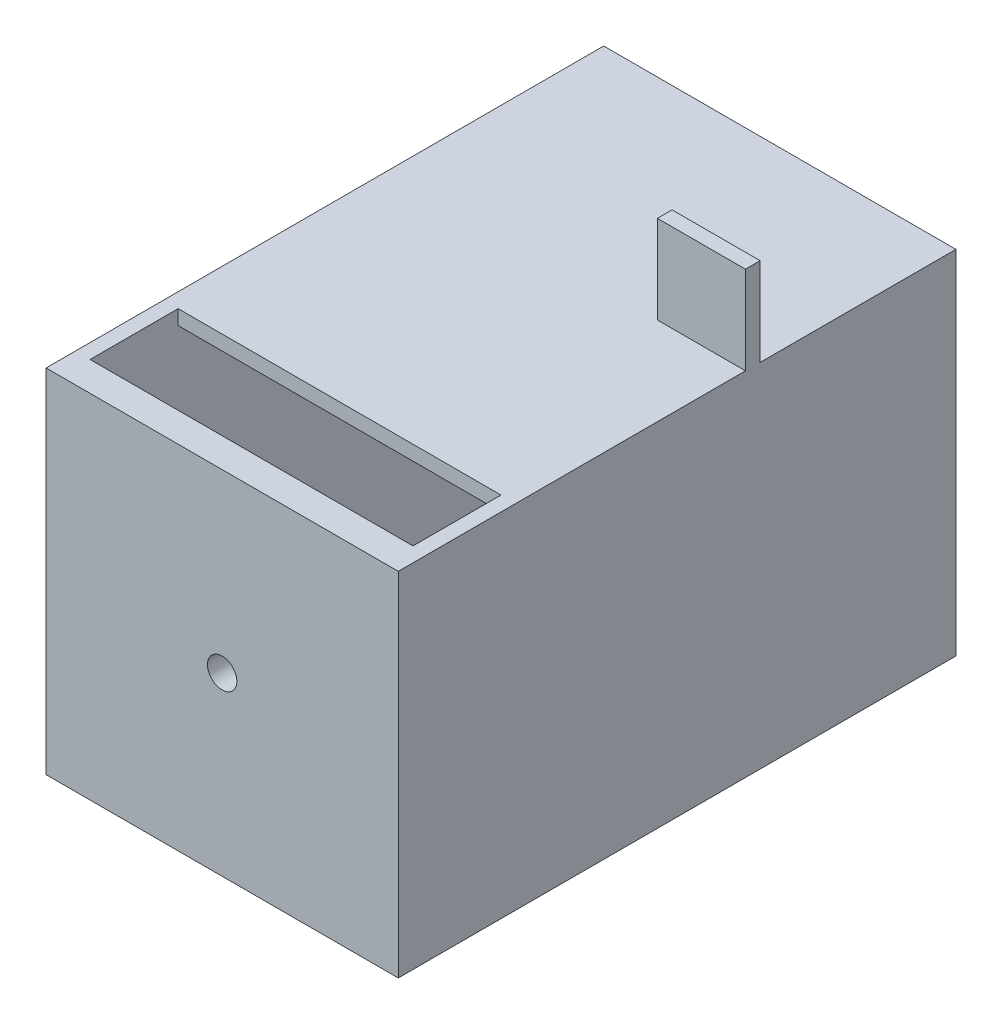
from build123d import *

# Parameters (mm, degrees)
BOSS_EXTRUDE1_DEPTH = 180
SKETCH2_W           = 120
SKETCH2_H           = 120
BOSS_EXTRUDE2_DEPTH = 10
SKETCH3_R           = 5
CUT_EXTRUDE1_DEPTH  = 10
SKETCH4_W           = 110
SKETCH4_H           = 30
CUT_EXTRUDE2_DEPTH  = 10
SKETCH5_W           = 30
SKETCH5_H           = 5
BOSS_EXTRUDE3_DEPTH = 30


with BuildPart() as part:
    # Sketch1 → Boss-Extrude1 (new body)
    with BuildSketch(Plane.XY):
        Polygon((-60, 60), (60, 60), (60, -60), (40, -60), (40, -55), (55, -55), (55, 55), (-55, 55), (-55, -55), (-40, -55), (-40, -60), (-60, -60), align=None)
    extrude(amount=BOSS_EXTRUDE1_DEPTH)

    # Sketch2 → Boss-Extrude2 (add)
    with BuildSketch(Plane.XY.offset(180)):
        Rectangle(SKETCH2_W, SKETCH2_H)
    extrude(amount=BOSS_EXTRUDE2_DEPTH)

    # Sketch3 → Cut-Extrude1 (cut)
    with BuildSketch(Plane.XY.offset(190)):
        Circle(SKETCH3_R)
    extrude(amount=-CUT_EXTRUDE1_DEPTH, mode=Mode.SUBTRACT)

    # Sketch4 → Cut-Extrude2 (cut)
    with BuildSketch(Plane(origin=(0, 60, 0), x_dir=(1, 0, 0), z_dir=(0, 1, 0))):
        with Locations((0, -165)):
            Rectangle(SKETCH4_W, SKETCH4_H)
    extrude(amount=-CUT_EXTRUDE2_DEPTH, mode=Mode.SUBTRACT)

    # Sketch5 → Boss-Extrude3 (add)
    with BuildSketch(Plane(origin=(0, 60, 0), x_dir=(1, 0, 0), z_dir=(0, 1, 0))):
        with Locations((45, -69.201770824)):
            Rectangle(SKETCH5_W, SKETCH5_H)
    extrude(amount=BOSS_EXTRUDE3_DEPTH)


solid = part.part
